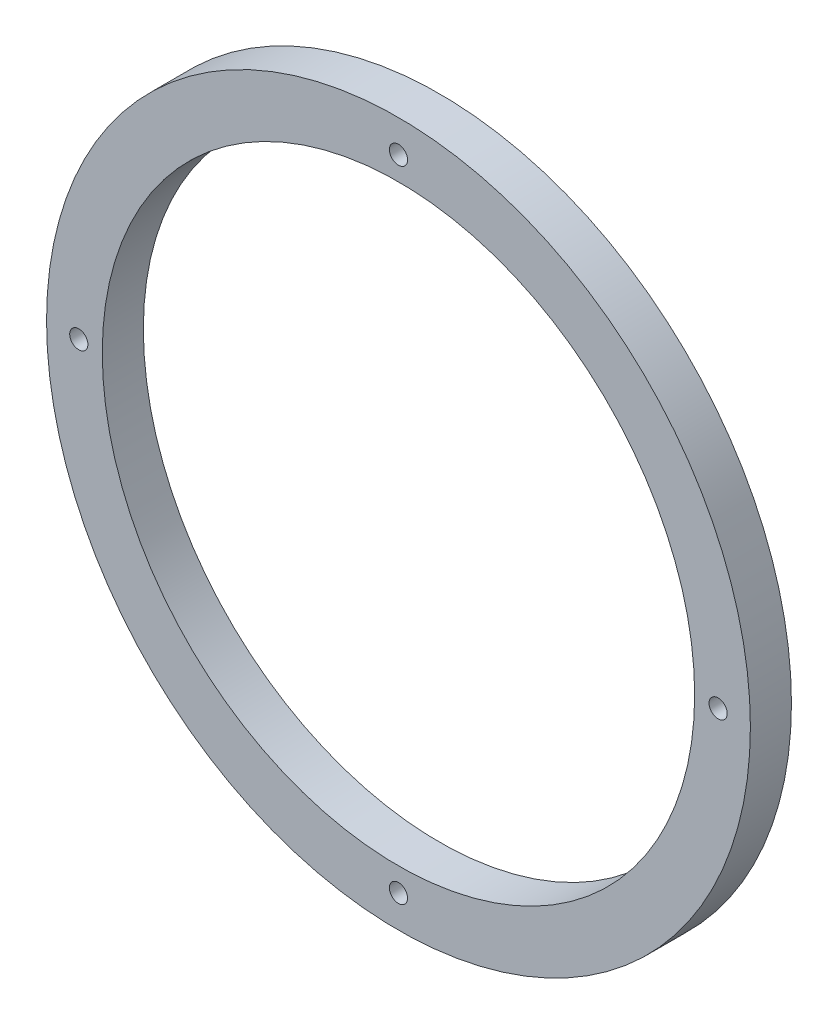
from build123d import *

# Parameters (mm, degrees)
SKETCH_1_R          = 60
SKETCH_1_R_2        = 50.5
EXTRUDE_1_DEPTH     = 7
SKETCH_2_R          = 1.55
CUT_EXTRUDE_1_DEPTH = 7


with BuildPart() as part:
    # 草图1 → 凸台-拉伸1 (new body)
    with BuildSketch(Plane.XY):
        Circle(SKETCH_1_R)
        Circle(SKETCH_1_R_2, mode=Mode.SUBTRACT)
    extrude(amount=EXTRUDE_1_DEPTH)

    # 草图2 → 切除-拉伸1 (cut)
    with BuildSketch(Plane.XY.offset(7)):
        with Locations((-54.5, 0)):
            Circle(SKETCH_2_R)
        with Locations((0, 54.5)):
            Circle(SKETCH_2_R)
        with Locations((54.5, 0)):
            Circle(SKETCH_2_R)
        with Locations((0, -54.5)):
            Circle(SKETCH_2_R)
    extrude(amount=-CUT_EXTRUDE_1_DEPTH, mode=Mode.SUBTRACT)


solid = part.part
